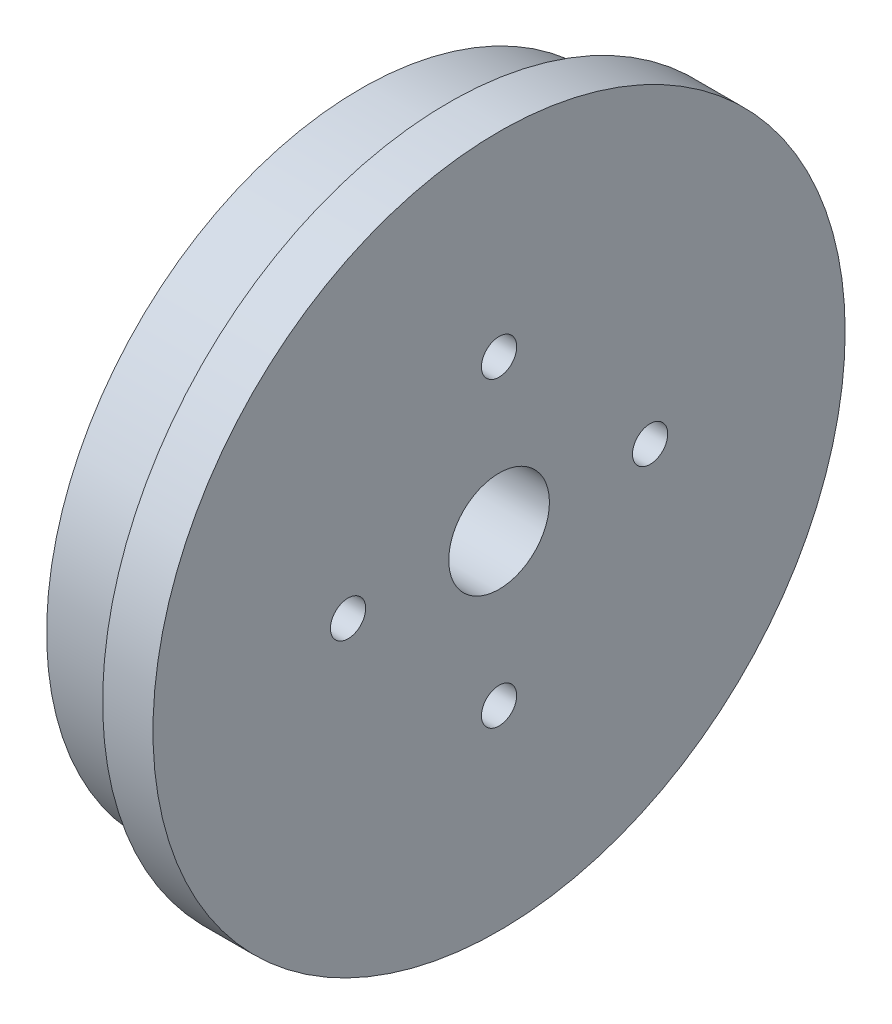
from build123d import *

# Parameters (mm, degrees)
SKETCH1_R          = 24.95
HUB_DEPTH          = 7
SKETCH2_R          = 27.5
SHOULDER_DEPTH     = 4
SKETCH3_R          = 4
CUT_EXTRUDE1_DEPTH = 41.416580756
SKETCH5_R          = 1.4
CUT_EXTRUDE3_DEPTH = 8
SKETCH6_R          = 3
CUT_EXTRUDE4_DEPTH = 6


with BuildPart() as part:
    # Sketch1 → Hub (new body)
    with BuildSketch(Plane(origin=(0, 0, 0), x_dir=(0, 0, -1), z_dir=(1, 0, 0))):
        Circle(SKETCH1_R)
    extrude(amount=HUB_DEPTH)

    # Sketch2 → Shoulder (add)
    with BuildSketch(Plane(origin=(7, 0, 0), x_dir=(0, 0, -1), z_dir=(1, 0, 0))):
        Circle(SKETCH2_R)
    extrude(amount=SHOULDER_DEPTH)

    # Sketch3 → Cut-Extrude1 (cut, through all)
    with BuildSketch(Plane(origin=(11, 0, 0), x_dir=(0, 0, -1), z_dir=(1, 0, 0))):
        Circle(SKETCH3_R)
    extrude(amount=-CUT_EXTRUDE1_DEPTH, mode=Mode.SUBTRACT)

    # Sketch5 → Cut-Extrude3 (cut)
    with BuildSketch(Plane(origin=(11, 0, 0), x_dir=(0, 0, -1), z_dir=(1, 0, 0))):
        with Locations((-12, 0)):
            Circle(SKETCH5_R)
        with Locations((0, 12)):
            Circle(SKETCH5_R)
        with Locations((12, 0)):
            Circle(SKETCH5_R)
        with Locations((0, -12)):
            Circle(SKETCH5_R)
    extrude(amount=-CUT_EXTRUDE3_DEPTH, mode=Mode.SUBTRACT)

    # Sketch6 → Cut-Extrude4 (cut)
    with BuildSketch(Plane.ZY):
        with Locations((0, 20)):
            Circle(SKETCH6_R)
        with Locations((18.186533479, 10.5)):
            Circle(SKETCH6_R)
        with Locations((19.052558883, -10)):
            Circle(SKETCH6_R)
        with Locations((1.732050808, -21)):
            Circle(SKETCH6_R)
        with Locations((-16.454482672, -11.5)):
            Circle(SKETCH6_R)
        with Locations((-17.320508076, 9)):
            Circle(SKETCH6_R)
    extrude(amount=-CUT_EXTRUDE4_DEPTH, mode=Mode.SUBTRACT)


solid = part.part
